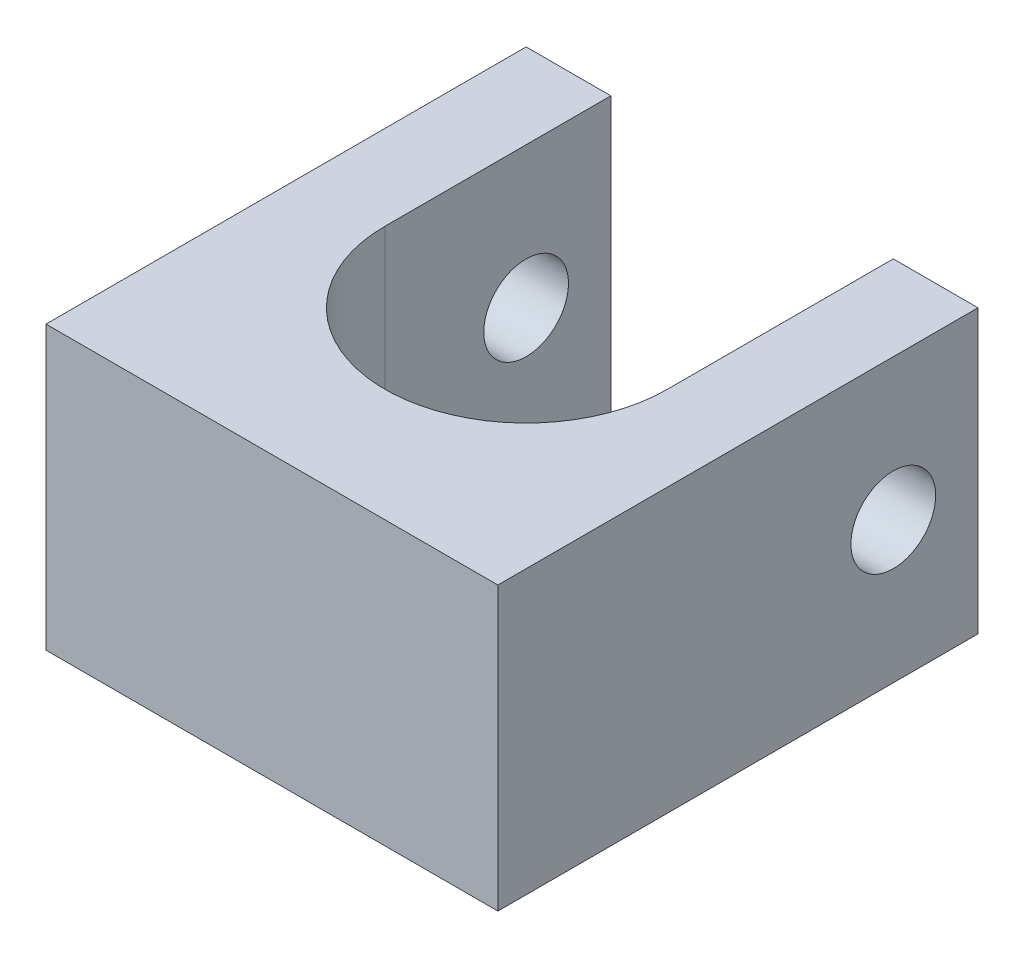
from build123d import *

# Parameters (mm, degrees)
SKETCH1_W           = 80
SKETCH1_H           = 50
BOSS_EXTRUDE1_DEPTH = 85
SKETCH3_W           = 50
SKETCH3_H           = 55.289699502
CUT_EXTRUDE1_DEPTH  = 40
SKETCH4_R           = 7.5
CUT_EXTRUDE3_DEPTH  = 120.373363863
CUT_EXTRUDE4_DEPTH  = 107.418983269


with BuildPart() as part:
    # Sketch1 → Boss-Extrude1 (new body)
    with BuildSketch(Plane.XY):
        Rectangle(SKETCH1_W, SKETCH1_H)
    extrude(amount=BOSS_EXTRUDE1_DEPTH)

    # Sketch3 → Cut-Extrude1 (cut)
    with BuildSketch(Plane(origin=(0, 0, 0), x_dir=(-1, 0, 0), z_dir=(0, 0, -1))):
        Rectangle(SKETCH3_W, SKETCH3_H)
    extrude(amount=-CUT_EXTRUDE1_DEPTH, mode=Mode.SUBTRACT)

    # Sketch4 → Cut-Extrude3 (cut, through all)
    with BuildSketch(Plane(origin=(40, 0, 0), x_dir=(0, 0, -1), z_dir=(1, 0, 0))):
        with Locations((-15, 0)):
            Circle(SKETCH4_R)
    extrude(amount=-CUT_EXTRUDE3_DEPTH, mode=Mode.SUBTRACT)

    # Sketch5 → Cut-Extrude4 (cut, through all)
    with BuildSketch(Plane(origin=(0, 25, 0), x_dir=(1, 0, 0), z_dir=(0, 1, 0))):
        with BuildLine():
            Line((25, -40), (-25, -40))
            ThreePointArc((-25, -40), (0, -65), (25, -40))
        make_face()
    extrude(amount=-CUT_EXTRUDE4_DEPTH, mode=Mode.SUBTRACT)


solid = part.part
